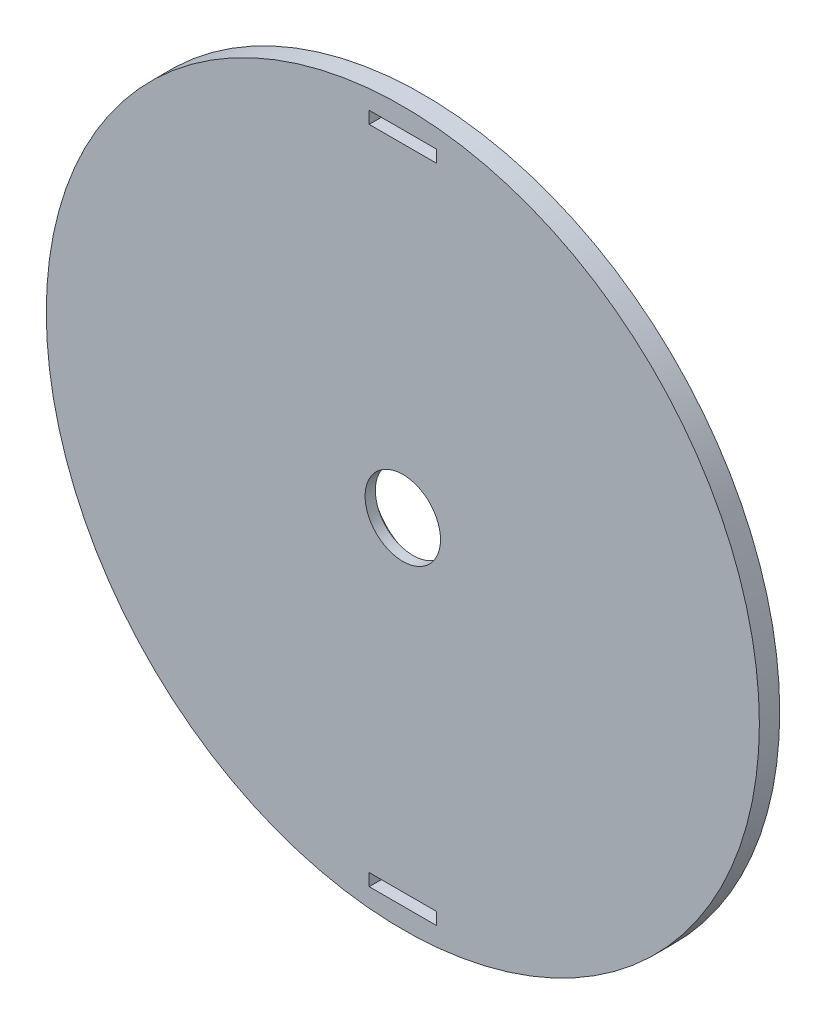
from build123d import *

# Parameters (mm, degrees)
SKETCH_1_R               = 87.5
EXTRUDE_1_DEPTH          = 5
SKETCH_7_W               = 16.5
SKETCH_7_H               = 3
CUT_EXTRUDE_3_DEPTH      = 10
PATTERN_CIRCULAR_1_COUNT = 2
SKETCH_8_W               = 16.1
SKETCH_8_H               = 30
CUT_EXTRUDE_4_DEPTH      = 2
PATTERN_CIRCULAR_2_COUNT = 2
SKETCH_9_R               = 9.25
CUT_EXTRUDE_5_DEPTH      = 2.5
SKETCH_10_R              = 12.6
CUT_EXTRUDE_6_DEPTH      = 2.5


with BuildPart() as part:
    # 草图1 → 凸台-拉伸1 (new body)
    with BuildSketch(Plane.XY):
        Circle(SKETCH_1_R)
    extrude(amount=EXTRUDE_1_DEPTH)

    # 草图7 → 切除-拉伸3 (cut)
    with BuildSketch(Plane(origin=(0, 0, 0), x_dir=(-1, 0, 0), z_dir=(0, 0, -1))):
        with Locations((0, 81)):
            Rectangle(SKETCH_7_W, SKETCH_7_H)
    cut_extrude_3 = extrude(amount=-CUT_EXTRUDE_3_DEPTH, mode=Mode.SUBTRACT)

    # 阵列(圆周)1: 切除-拉伸3 ×2 about axis
    pattern_circular_1_axis = Axis((0, 0, 0), (0, 0, 1))
    for i in range(1, PATTERN_CIRCULAR_1_COUNT):
        add(cut_extrude_3.rotate(pattern_circular_1_axis, i * 360 / PATTERN_CIRCULAR_1_COUNT), mode=Mode.SUBTRACT)

    # 草图8 → 切除-拉伸4 (cut)
    with BuildSketch(Plane(origin=(0, 0, 0), x_dir=(-1, 0, 0), z_dir=(0, 0, -1))):
        with Locations((0, 64.5)):
            Rectangle(SKETCH_8_W, SKETCH_8_H)
    cut_extrude_4 = extrude(amount=-CUT_EXTRUDE_4_DEPTH, mode=Mode.SUBTRACT)

    # 阵列(圆周)2: 切除-拉伸4 ×2 about axis
    pattern_circular_2_axis = Axis((0, 0, 0), (0, 0, 1))
    for i in range(1, PATTERN_CIRCULAR_2_COUNT):
        add(cut_extrude_4.rotate(pattern_circular_2_axis, i * 360 / PATTERN_CIRCULAR_2_COUNT), mode=Mode.SUBTRACT)

    # 草图9 → 切除-拉伸5 (cut)
    with BuildSketch(Plane.XY.offset(5)):
        Circle(SKETCH_9_R)
    extrude(amount=-CUT_EXTRUDE_5_DEPTH, mode=Mode.SUBTRACT)

    # 草图10 → 切除-拉伸6 (cut)
    with BuildSketch(Plane(origin=(0, 0, 0), x_dir=(-1, 0, 0), z_dir=(0, 0, -1))):
        Circle(SKETCH_10_R)
    extrude(amount=-CUT_EXTRUDE_6_DEPTH, mode=Mode.SUBTRACT)


solid = part.part
